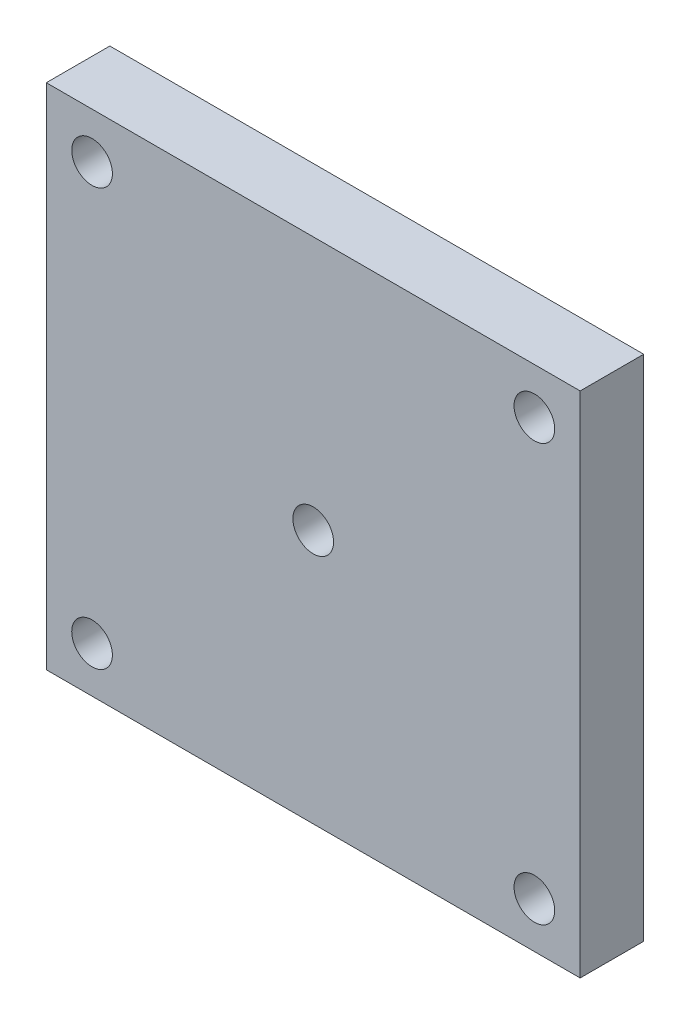
from build123d import *

# Parameters (mm, degrees)
SKETCH1_W           = 42
SKETCH1_H           = 40
BOSS_EXTRUDE1_DEPTH = 2.5
SKETCH2_R           = 1.6
CUT_EXTRUDE1_DEPTH  = 30.427877939


with BuildPart() as part:
    # Sketch1 → Boss-Extrude1 (new, symmetric)
    with BuildSketch(Plane.XY):
        Rectangle(SKETCH1_W, SKETCH1_H)
    extrude(amount=BOSS_EXTRUDE1_DEPTH, both=True)

    # Sketch2 → Cut-Extrude1 (cut, through all)
    with BuildSketch(Plane.XY.offset(2.5)):
        with Locations((-17.4, 16.4)):
            Circle(SKETCH2_R)
        with Locations(Location((17.4, 16.4, 0), (0, 0, 180))):
            Circle(SKETCH2_R)
        with Locations((17.4, -16.4)):
            Circle(SKETCH2_R)
        with Locations(Location((-17.4, -16.4, 0), (0, 0, 180))):
            Circle(SKETCH2_R)
        Circle(SKETCH2_R)
    extrude(amount=-CUT_EXTRUDE1_DEPTH, mode=Mode.SUBTRACT)


solid = part.part
